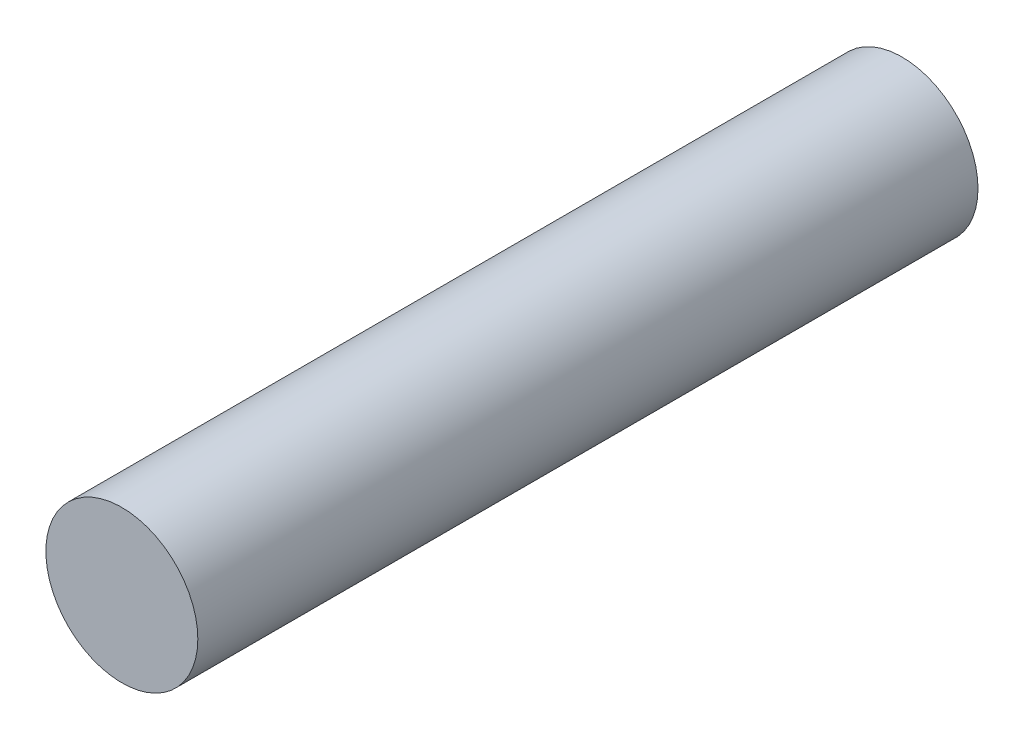
from build123d import *

# Parameters (mm, degrees)
SKETCH1_R           = 0.9525
BOSS_EXTRUDE1_DEPTH = 9.779


with BuildPart() as part:
    # Sketch1 → Boss-Extrude1 (new body)
    with BuildSketch(Plane.XY):
        Circle(SKETCH1_R)
    extrude(amount=BOSS_EXTRUDE1_DEPTH)


solid = part.part
